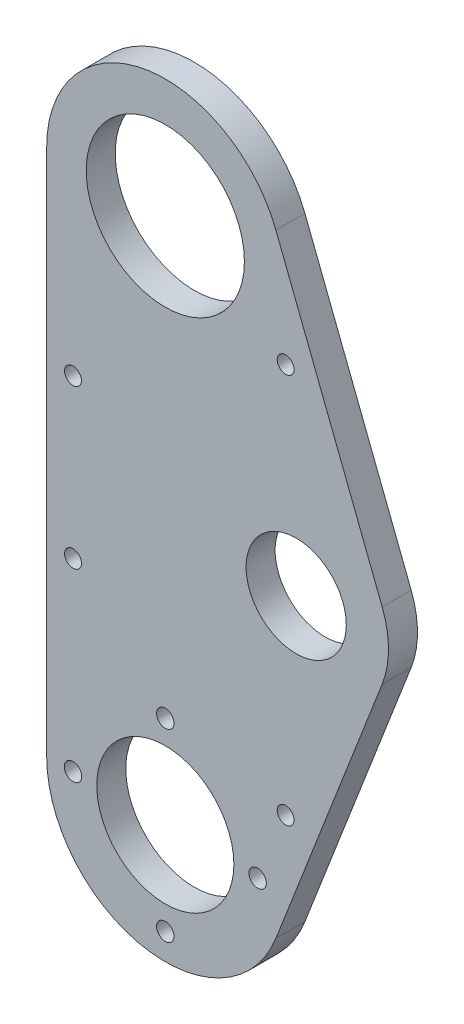
from build123d import *
from build123d.topology import SkipClean

# Parameters (mm, degrees)
EXTRUDE_1_DEPTH          = 2.75
SKETCH_2_R               = 9.5
CUT_EXTRUDE_1_DEPTH      = 87.748932825
SKETCH_3_R               = 1.65
CUT_EXTRUDE_2_DEPTH      = 87.748932825
CUT_EXTRUDE_3_DEPTH      = 87.748932825
CUT_EXTRUDE_3_DEPTH_BACK = 87.748932825
SKETCH_4_R               = 13
PATTERN_CIRCULAR_1_COUNT = 4
SKETCH_6_R               = 1.6
CUT_EXTRUDE_5_DEPTH      = 87.748932825
CUT_EXTRUDE_4_DEPTH      = 87.748932825
CUT_EXTRUDE_4_DEPTH_BACK = 87.748932825
SKETCH_5_R               = 15
CUT_EXTRUDE_7_DEPTH      = 87.748932825
CUT_EXTRUDE_7_DEPTH_BACK = 87.748932825
SKETCH_8_R               = 1.6


with BuildPart() as part:
    # ｽｹｯﾁ1 → ﾎﾞｽ - 押し出し1 (new, symmetric)
    with BuildSketch(Plane.XY):
        with BuildLine():
            Line((17.5, 0), (-47.316776584, 0))
            Line((-47.316776584, 0), (-47.316776584, -50))
            ThreePointArc((-47.316776584, -50), (-28.966828956, -72.113956347), (-3.847704112, -58.157695734))
            Line((-3.847704112, -58.157695734), (16.309278589, -6.34487446))
            ThreePointArc((16.309278589, -6.34487446), (17.199743825, -3.227818512), (17.5, 0))
        make_face()
    extrude_1 = extrude(amount=EXTRUDE_1_DEPTH, both=True)

    # ｽｹｯﾁ2 → ｶｯﾄ - 押し出し1 (cut, symmetric)
    with BuildSketch(Plane.XY.offset(2.75)):
        Circle(SKETCH_2_R)
    cut_extrude_1 = extrude(amount=CUT_EXTRUDE_1_DEPTH, both=True, mode=Mode.SUBTRACT)

    # ｽｹｯﾁ3 → ｶｯﾄ - 押し出し2 (cut, symmetric)
    with BuildSketch(Plane.XY.offset(2.75)):
        with Locations((-24.816776584, -67.5)):
            Circle(SKETCH_3_R)
    cut_extrude_2 = extrude(amount=CUT_EXTRUDE_2_DEPTH, both=True, mode=Mode.SUBTRACT)

    # ｽｹｯﾁ4 → ｶｯﾄ - 押し出し3 (cut, two sides: drawn at the far end of the back side and taken through both)
    with BuildSketch(Plane.XY.offset(2.75).offset(-CUT_EXTRUDE_3_DEPTH_BACK)):
        with Locations((-24.816776584, -50)):
            Circle(SKETCH_4_R)
    extrude(amount=CUT_EXTRUDE_3_DEPTH + CUT_EXTRUDE_3_DEPTH_BACK, mode=Mode.SUBTRACT)

    # 円形ﾊﾟﾀｰﾝ1: ｶｯﾄ - 押し出し2 ×4 about axis
    pattern_circular_1_axis = Axis((-24.816776584, -50, 0), (0, 0, 1))
    for i in range(1, PATTERN_CIRCULAR_1_COUNT):
        add(cut_extrude_2.rotate(pattern_circular_1_axis, i * 360 / PATTERN_CIRCULAR_1_COUNT), mode=Mode.SUBTRACT)

    # ｽｹｯﾁ6 → ｶｯﾄ - 押し出し5 (cut, through all)
    with BuildSketch(Plane.XY.offset(2.75)):
        with Locations((-2, -37)):
            Circle(SKETCH_6_R)
    cut_extrude_5 = extrude(amount=-CUT_EXTRUDE_5_DEPTH, mode=Mode.SUBTRACT)

    # ﾐﾗｰ1: ﾎﾞｽ - 押し出し1, ｶｯﾄ - 押し出し1, ｶｯﾄ - 押し出し5 across plane
    with SkipClean():  # the faces are left unmerged after this step: merging them gives an invalid solid
        add(extrude_1.mirror(Plane.ZX))
        add(cut_extrude_1.mirror(Plane.ZX), mode=Mode.SUBTRACT)
        add(cut_extrude_5.mirror(Plane.ZX), mode=Mode.SUBTRACT)

    # ｽｹｯﾁ5 → ｶｯﾄ - 押し出し4 (cut, two sides: drawn at the far end of the back side and taken through both)
    with SkipClean():  # the faces are left unmerged after this step: merging them gives an invalid solid
        with BuildSketch(Plane.XY.offset(2.75).offset(-CUT_EXTRUDE_4_DEPTH_BACK)):
            with Locations((-24.816776584, 50)):
                Circle(SKETCH_5_R)
        extrude(amount=CUT_EXTRUDE_4_DEPTH + CUT_EXTRUDE_4_DEPTH_BACK, mode=Mode.SUBTRACT)

    # ｽｹｯﾁ8 → ｶｯﾄ - 押し出し7 (cut, two sides: drawn at the far end of the back side and taken through both)
    with SkipClean():  # the faces are left unmerged after this step: merging them gives an invalid solid
        with BuildSketch(Plane.XY.offset(2.75).offset(-CUT_EXTRUDE_7_DEPTH_BACK)):
            with Locations((-42.316776584, 15)):
                Circle(SKETCH_8_R)
            with Locations((-42.316776584, -15)):
                Circle(SKETCH_8_R)
        extrude(amount=CUT_EXTRUDE_7_DEPTH + CUT_EXTRUDE_7_DEPTH_BACK, mode=Mode.SUBTRACT)


solid = part.part
